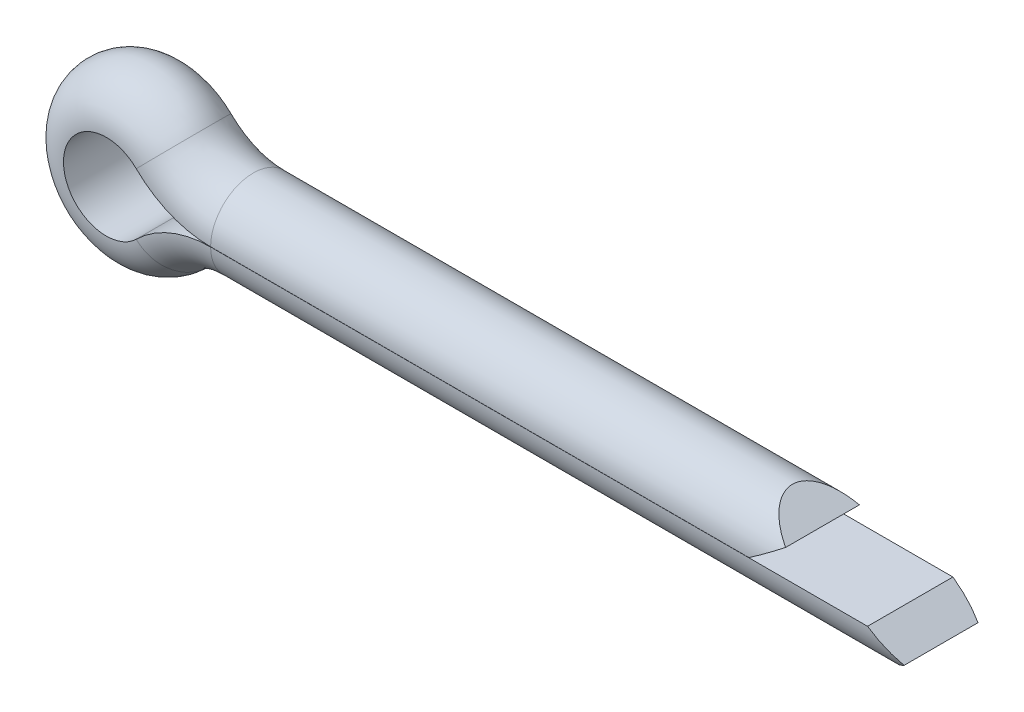
from build123d import *

# Parameters (mm, degrees)
CONECUT_DEPTH      = 15.638988918
CONECUT_DEPTH_BACK = 15.638988918


with BuildPart() as part:
    # Body: sweep along a path in PathSke
    with BuildLine(Plane.XY) as body_path:
        Line((12, 0.9), (0, 0.9))
        ThreePointArc((0, 0.9), (-0.50694731, 0.999684353), (-0.93840708, 1.283893805))
        ThreePointArc((-0.93840708, 1.283893805), (-4, 0), (-0.93840708, -1.283893805))
        ThreePointArc((-0.93840708, -1.283893805), (-0.50694731, -0.999684353), (0, -0.9))
        Line((0, -0.9), (14.5, -0.9))
    # SectionSke → Body (sweep)
    with BuildSketch(Plane(origin=(12, 0, 0), x_dir=(0, 0, -1), z_dir=(1, 0, 0))):
        with BuildLine():
            Line((-0.899997778, 0.002), (0.899997778, 0.002))
            ThreePointArc((0.899997778, 0.002), (0, 0.9), (-0.899997778, 0.002))
        make_face()
    sweep(path=body_path.line)

    # ConeCutSke → ConeCut (cut, two sides: drawn at the far end of the back side and taken through both)
    with BuildSketch(Plane.XY.offset(-CONECUT_DEPTH_BACK)):
        Polygon((12, 0.451), (11.352993487, 0.91), (14.51, 0.91), (14.51, -0.91), (13.852993487, -0.91), (14.5, -0.451), (13.847391827, 0), (11.347391827, 0), align=None)
    extrude(amount=CONECUT_DEPTH + CONECUT_DEPTH_BACK, mode=Mode.SUBTRACT)


solid = part.part
